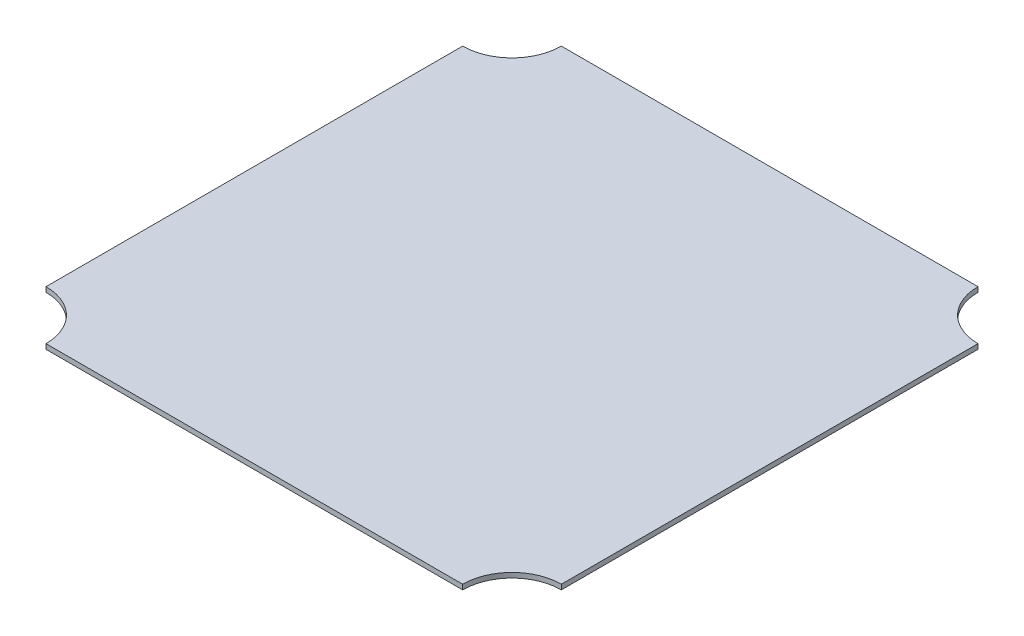
from build123d import *

# Parameters (mm, degrees)
EXTRUDE_1_DEPTH = 5


with BuildPart() as part:
    # 草图2 → 凸台-拉伸1 (new body)
    with BuildSketch(Plane(origin=(0, 0, 0), x_dir=(1, 0, 0), z_dir=(0, 1, 0))):
        with BuildLine():
            Line((-261, -211), (-261, 211))
            ThreePointArc((-261, 211), (-225.644660941, 225.644660941), (-211, 261))
            Line((-211, 261), (211, 261))
            ThreePointArc((211, 261), (225.644660941, 225.644660941), (261, 211))
            Line((261, 211), (261, -211))
            ThreePointArc((261, -211), (225.644660941, -225.644660941), (211, -261))
            Line((211, -261), (-211, -261))
            ThreePointArc((-211, -261), (-225.644660941, -225.644660941), (-261, -211))
        make_face()
    extrude(amount=EXTRUDE_1_DEPTH)


solid = part.part
